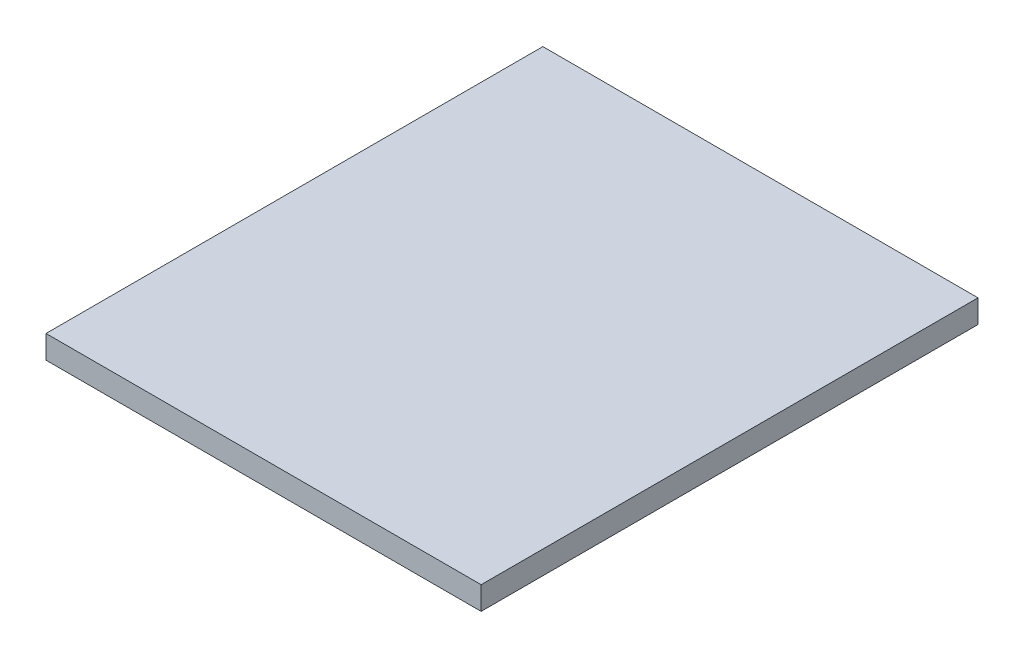
from build123d import *

# Parameters (mm, degrees)
SKETCH1_W           = 28.2
SKETCH1_H           = 32.2
BOSS_EXTRUDE1_DEPTH = 1.5


with BuildPart() as part:
    # Sketch1 → Boss-Extrude1 (new body)
    with BuildSketch(Plane(origin=(0, 0, 0), x_dir=(1, 0, 0), z_dir=(0, 1, 0))):
        with Locations((14.1, 16.1)):
            Rectangle(SKETCH1_W, SKETCH1_H)
    extrude(amount=BOSS_EXTRUDE1_DEPTH)


solid = part.part
